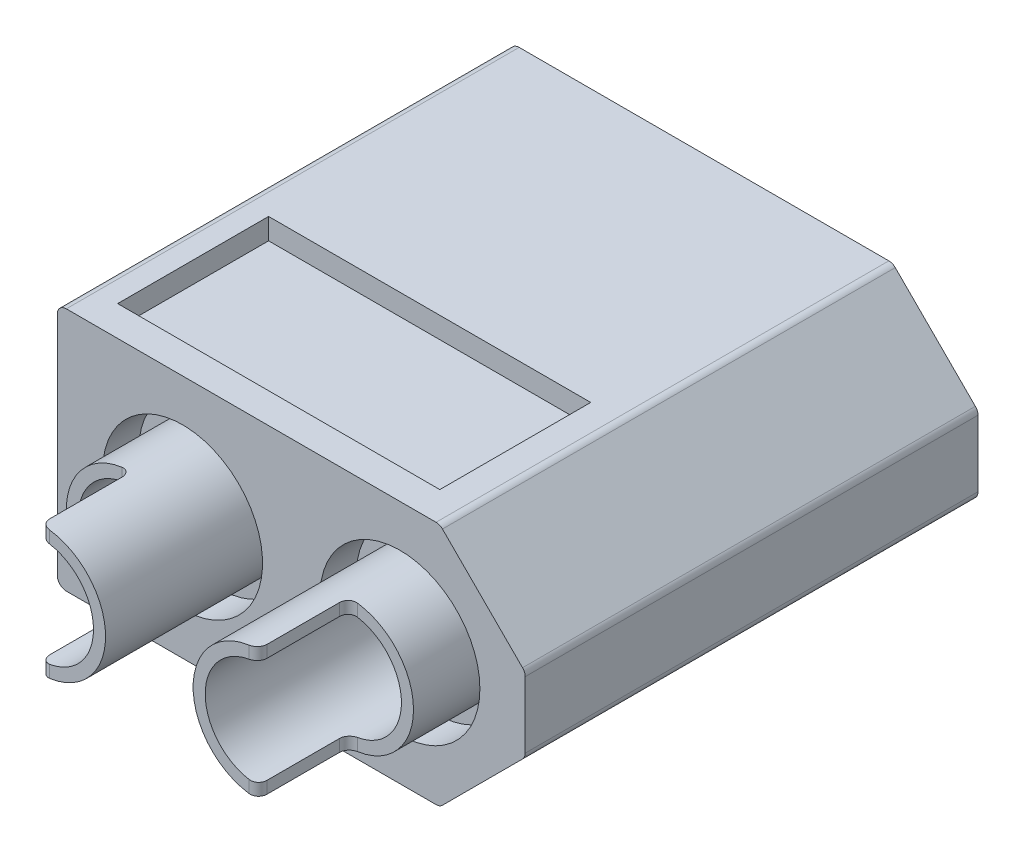
from build123d import *

# Parameters (mm, degrees)
EXTRUDE_1_DEPTH          = 15
CUT_EXTRUDE_1_DEPTH      = 7.7
SKETCH_3_W               = 1.5
SKETCH_3_H               = 1.2
EXTRUDE_2_DEPTH          = 6.2
SKETCH_4_W               = 1.5
SKETCH_4_H               = 4
CUT_EXTRUDE_2_DEPTH      = 1.2
EXTRUDE_3_DEPTH          = 6.5
EXTRUDE_3_DEPTH_BACK     = 12
SKETCH_5_R               = 2.15
SKETCH_6_R               = 2.65
SKETCH_6_R_2             = 2.15
CUT_EXTRUDE_3_DEPTH      = 1.2
SKETCH_7_R               = 1.75
CUT_EXTRUDE_4_DEPTH      = 9
CUT_EXTRUDE_5_DEPTH      = 22.553537993
CUT_EXTRUDE_5_DEPTH_BACK = 22.553537993
SKETCH_8_W               = 2.15
SKETCH_8_H               = 3
CUT_EXTRUDE_START        = -5.5
SKETCH_10_R              = 2.15
SKETCH_10_R_2            = 1.95
CUT_EXTRUDE_7_DEPTH      = 5.5
CUT_EXTRUDE_START_2      = -6
CUT_EXTRUDE_6_DEPTH      = 6
FILLET_1_R               = 1
FILLET_2_R               = 0.3
SKETCH_11_W              = 10.671572875
SKETCH_11_H              = 5
CUT_EXTRUDE_8_DEPTH      = 0.7
SKETCH_12_W              = 0.743589744
SKETCH_12_H              = 0.230769231
EXTRUDE_4_DEPTH          = 0.2
FILLET_3_R               = 0.3


with BuildPart() as part:
    # Эскиз1 → Бобышка-Вытянуть1 (new body)
    with BuildSketch(Plane.XY):
        Polygon((7.75, 1.221572875), (4.921572875, 4.05), (-7.75, 4.05), (-7.75, -4.05), (4.921572875, -4.05), (7.75, -1.221572875), align=None)
    extrude(amount=EXTRUDE_1_DEPTH)

    # Эскиз2 → Вырез-Вытянуть1 (cut)
    with BuildSketch(Plane(origin=(0, 0, 0), x_dir=(-1, 0, 0), z_dir=(0, 0, -1))):
        Polygon((-4.631623382, -3.35), (7.05, -3.35), (7.05, 3.35), (-4.631623382, 3.35), (-7.05, 0.931623382), (-7.05, -0.931623382), align=None)
    extrude(amount=-CUT_EXTRUDE_1_DEPTH, mode=Mode.SUBTRACT)

    # Эскиз3 → Бобышка-Вытянуть2 (add)
    with BuildSketch(Plane(origin=(0, 0, 1.5), x_dir=(-1, 0, 0), z_dir=(0, 0, -1))):
        with Locations((0, 2.75)):
            Rectangle(SKETCH_3_W, SKETCH_3_H)
    extrude(amount=-EXTRUDE_2_DEPTH)

    # Эскиз4 → Вырез-Вытянуть2 (cut)
    with BuildSketch(Plane(origin=(0, 0, 7.7), x_dir=(-1, 0, 0), z_dir=(0, 0, -1))):
        with Locations((0, 0.15)):
            Rectangle(SKETCH_4_W, SKETCH_4_H)
    extrude(amount=-CUT_EXTRUDE_2_DEPTH, mode=Mode.SUBTRACT)

    # Эскиз5 → Бобышка-Вытянуть3 (add, two sides: drawn at the far end of the back side and taken through both)
    with BuildSketch(Plane(origin=(0, 0, 7.7), x_dir=(-1, 0, 0), z_dir=(0, 0, -1)).offset(-EXTRUDE_3_DEPTH_BACK)):
        with Locations(Location((3.6, 0, 0), (0, 0, 180))):
            Circle(SKETCH_5_R)
        with Locations(Location((-3.6, 0, 0), (0, 0, 180))):
            Circle(SKETCH_5_R)
    extrude(amount=EXTRUDE_3_DEPTH + EXTRUDE_3_DEPTH_BACK)

    # Эскиз6 → Вырез-Вытянуть3 (cut)
    # profile 1 of 2: a face of its own
    with BuildSketch(Plane.XY.offset(15)):
        with Locations((3.6, 0)):
            Circle(SKETCH_6_R)
        with Locations((3.6, 0)):
            Circle(SKETCH_6_R_2, mode=Mode.SUBTRACT)
    # profile 2 of 2: a face of its own
    with BuildSketch(Plane.XY.offset(15)):
        with Locations(Location((-3.6, 0, 0), (0, 0, 180))):
            Circle(SKETCH_6_R)
        with Locations((-3.6, 0)):
            Circle(SKETCH_6_R_2, mode=Mode.SUBTRACT)
    extrude(amount=-CUT_EXTRUDE_3_DEPTH, mode=Mode.SUBTRACT)

    # Эскиз7 → Вырез-Вытянуть4 (cut)
    with BuildSketch(Plane.XY.offset(19.7)):
        with Locations((-3.6, 0)):
            Circle(SKETCH_7_R)
        with Locations(Location((3.6, 0, 0), (0, 0, 180))):
            Circle(SKETCH_7_R)
    extrude(amount=-CUT_EXTRUDE_4_DEPTH, mode=Mode.SUBTRACT)

    # Эскиз8 → Вырез-Вытянуть5 (cut, two sides: drawn at the far end of the back side and taken through both)
    with BuildSketch(Plane(origin=(0, 0, 0), x_dir=(1, 0, 0), z_dir=(0, 1, 0)).offset(-CUT_EXTRUDE_5_DEPTH_BACK)):
        with Locations((4.675, -18.2)):
            Rectangle(SKETCH_8_W, SKETCH_8_H)
        with Locations((-4.675, -18.2)):
            Rectangle(SKETCH_8_W, SKETCH_8_H)
    extrude(amount=CUT_EXTRUDE_5_DEPTH + CUT_EXTRUDE_5_DEPTH_BACK, mode=Mode.SUBTRACT)

    # Эскиз10 → Вырез-Вытянуть7 (cut)
    # profile 1 of 2: a face of its own
    with BuildSketch(Plane(origin=(0, 0, 1.2), x_dir=(-1, 0, 0), z_dir=(0, 0, -1)).offset(CUT_EXTRUDE_START)):
        with Locations(Location((3.6, 0, 0), (0, 0, 180))):
            Circle(SKETCH_10_R)
        with Locations((3.6, 0)):
            Circle(SKETCH_10_R_2, mode=Mode.SUBTRACT)
    # profile 2 of 2: a face of its own
    with BuildSketch(Plane(origin=(0, 0, 1.2), x_dir=(-1, 0, 0), z_dir=(0, 0, -1)).offset(CUT_EXTRUDE_START)):
        with Locations(Location((-3.6, 0, 0), (0, 0, 180))):
            Circle(SKETCH_10_R)
        with Locations(Location((-3.6, 0, 0), (0, 0, 180))):
            Circle(SKETCH_10_R_2, mode=Mode.SUBTRACT)
    extrude(amount=CUT_EXTRUDE_7_DEPTH, mode=Mode.SUBTRACT)

    # Эскиз9 → Вырез-Вытянуть6 (cut)
    with BuildSketch(Plane(origin=(0, 0, 1.2), x_dir=(-1, 0, 0), z_dir=(0, 0, -1)).offset(CUT_EXTRUDE_START_2)):
        with BuildLine():
            ThreePointArc((3.45, -1.94422221), (3.6, -1.95), (3.75, -1.94422221))
            Line((3.75, -1.94422221), (3.75, -0.734846923))
            ThreePointArc((3.75, -0.734846923), (4.130330086, -0.530330086), (4.334846923, -0.15))
            Line((4.334846923, -0.15), (5.54422221, -0.15))
            ThreePointArc((5.54422221, -0.15), (5.548555017, -0.075055617), (5.55, 0))
            ThreePointArc((5.55, 0), (5.548555017, 0.075055617), (5.54422221, 0.15))
            Line((5.54422221, 0.15), (4.334846923, 0.15))
            ThreePointArc((4.334846923, 0.15), (4.130330086, 0.530330086), (3.75, 0.734846923))
            Line((3.75, 0.734846923), (3.75, 1.94422221))
            ThreePointArc((3.75, 1.94422221), (3.6, 1.95), (3.45, 1.94422221))
            Line((3.45, 1.94422221), (3.45, 0.734846923))
            ThreePointArc((3.45, 0.734846923), (3.069669914, 0.530330086), (2.865153077, 0.15))
            Line((2.865153077, 0.15), (1.65577779, 0.15))
            ThreePointArc((1.65577779, 0.15), (1.65, 0), (1.65577779, -0.15))
            Line((1.65577779, -0.15), (2.865153077, -0.15))
            ThreePointArc((2.865153077, -0.15), (3.069669914, -0.530330086), (3.45, -0.734846923))
            Line((3.45, -0.734846923), (3.45, -1.94422221))
        make_face()
        with BuildLine():
            ThreePointArc((-3.75, -0.734846923), (-4.130330086, -0.530330086), (-4.334846923, -0.15))
            Line((-4.334846923, -0.15), (-6.1, -0.15))
            Line((-6.1, -0.15), (-6.1, 0.15))
            Line((-6.1, 0.15), (-4.334846923, 0.15))
            ThreePointArc((-4.334846923, 0.15), (-4.130330086, 0.530330086), (-3.75, 0.734846923))
            Line((-3.75, 0.734846923), (-3.75, 2.5))
            Line((-3.75, 2.5), (-3.45, 2.5))
            Line((-3.45, 2.5), (-3.45, 0.734846923))
            ThreePointArc((-3.45, 0.734846923), (-3.069669914, 0.530330086), (-2.865153077, 0.15))
            Line((-2.865153077, 0.15), (-1.1, 0.15))
            Line((-1.1, 0.15), (-1.1, -0.15))
            Line((-1.1, -0.15), (-2.865153077, -0.15))
            ThreePointArc((-2.865153077, -0.15), (-3.069669914, -0.530330086), (-3.45, -0.734846923))
            Line((-3.45, -0.734846923), (-3.45, -2.5))
            Line((-3.45, -2.5), (-3.75, -2.5))
            Line((-3.75, -2.5), (-3.75, -0.734846923))
        make_face()
    extrude(amount=CUT_EXTRUDE_6_DEPTH, mode=Mode.SUBTRACT)

    # Скругление1
    fillet_1_edges = [part.edges().sort_by_distance(p)[0] for p in [
        (4.978858223, -1.378858223, 1.2),
        (-4.978858223, 1.378858223, 1.2),
        (-2.221141777, 1.378858223, 1.2),
        (-2.221141777, -1.378858223, 1.2),
        (-4.978858223, -1.378858223, 1.2),
        (2.221141777, -1.378858223, 1.2),
        (2.221141777, 1.378858223, 1.2),
        (4.978858223, 1.378858223, 1.2),
    ]]
    fillet(fillet_1_edges, radius=FILLET_1_R)

    # Скругление2
    fillet_2_edges = [part.edges().sort_by_distance(p)[0] for p in [
        (-3.6, 1.95, 16.7),
        (-3.6, -1.95, 16.7),
        (-3.6, 1.95, 19.7),
        (-3.6, -1.95, 19.7),
        (3.6, -1.95, 19.7),
        (3.6, 1.95, 19.7),
        (3.6, 1.95, 16.7),
        (3.6, -1.95, 16.7),
    ]]
    fillet(fillet_2_edges, radius=FILLET_2_R)

    # Эскиз11 → Вырез-Вытянуть8 (cut)
    with BuildSketch(Plane(origin=(0, 4.05, 0), x_dir=(1, 0, 0), z_dir=(0, 1, 0))):
        with Locations((-1.414213562, -11.5)):
            Rectangle(SKETCH_11_W, SKETCH_11_H)
    cut_extrude_8 = extrude(amount=-CUT_EXTRUDE_8_DEPTH, mode=Mode.SUBTRACT)

    # Зеркальное отражение1: Вырез-Вытянуть8 across plane
    add(cut_extrude_8.mirror(Plane.ZX), mode=Mode.SUBTRACT)

    # Эскиз12 → Бобышка-Вытянуть4 (add)
    # profile 1 of 5: a face of its own
    with BuildSketch(Plane.XZ.offset(3.35)):
        with BuildLine():
            Line((2.409553644, 12.5), (1.670370952, 11.423878205))
            Line((1.670370952, 11.423878205), (2.306989542, 10.5))
            Line((2.306989542, 10.5), (1.967245952, 10.5))
            Line((1.967245952, 10.5), (1.618287619, 11.006410256))
            add(Edge.make_bspline(
                [(1.618287619, 11.006410256), (1.609716279, 11.019080657), (1.593631875, 11.042857083), (1.57132612, 11.076612212), (1.552930289, 11.106570753), (1.538116623, 11.132498509), (1.52669851, 11.154212753), (1.518724987, 11.171824354), (1.514563909, 11.185833759), (1.514533668, 11.193896175), (1.514521593, 11.197115385)],
                knots=[0, 0, 0, 0, 1.676374632, 3.145772549, 4.433387901, 5.527971266, 6.418173079, 7.119576872, 7.648459376, 8, 8, 8, 8], degree=3))
            add(Edge.make_bspline(
                [(1.514521593, 11.197115385), (1.505939018, 11.184719792), (1.487172134, 11.157615267), (1.45748844, 11.112979609), (1.42192354, 11.062359172), (1.397091731, 11.026070545), (1.383912619, 11.006810897)],
                knots=[0, 0, 0, 0, 0.783829651, 1.713942406, 2.786709065, 4, 4, 4, 4], degree=3))
            Line((1.383912619, 11.006810897), (1.036156209, 10.5))
            Line((1.036156209, 10.5), (0.691604927, 10.5))
            Line((0.691604927, 10.5), (1.328223516, 11.427083333))
            Line((1.328223516, 11.427083333), (0.589040824, 12.5))
            Line((0.589040824, 12.5), (0.929185055, 12.5))
            Line((0.929185055, 12.5), (1.415963901, 11.793269231))
            add(Edge.make_bspline(
                [(1.415963901, 11.793269231), (1.429874296, 11.773252023), (1.457377052, 11.733675264), (1.484627598, 11.693924429), (1.498095311, 11.674278846)],
                knots=[0, 0, 0, 0, 1.011563749, 2, 2, 2, 2], degree=3))
            add(Edge.make_bspline(
                [(1.498095311, 11.674278846), (1.508350537, 11.689255237), (1.527228888, 11.716824555), (1.55350676, 11.754365325), (1.574243279, 11.785462974), (1.58675493, 11.803696514), (1.592245952, 11.811698718)],
                knots=[0, 0, 0, 0, 1.307556106, 2.407017115, 3.300883259, 4, 4, 4, 4], degree=3))
            Line((1.592245952, 11.811698718), (2.065403003, 12.5))
            Line((2.065403003, 12.5), (2.409553644, 12.5))
        make_face()
    # profile 2 of 5: a face of its own
    with BuildSketch(Plane.XZ.offset(3.35)):
        Polygon((-0.142529689, 12.5), (-0.142529689, 10.730769231), (0.498495952, 10.730769231), (0.498495952, 10.5), (-1.065606612, 10.5), (-1.065606612, 10.730769231), (-0.424580971, 10.730769231), (-0.424580971, 12.5), align=None)
    # profile 3 of 5: a face of its own
    with BuildSketch(Plane.XZ.offset(3.35)):
        with Locations((-1.565606612, 11.794871795)):
            Rectangle(SKETCH_12_W, SKETCH_12_H)
    # profile 4 of 5: a face of its own
    with BuildSketch(Plane.XZ.offset(3.35)):
        with BuildLine():
            Line((-3.424580971, 11.012820513), (-3.168170714, 11.038461538))
            add(Edge.make_bspline(
                [(-3.168170714, 11.038461538), (-3.162637587, 11.016408888), (-3.152222327, 10.974898169), (-3.130381624, 10.91859514), (-3.106313636, 10.870972353), (-3.085403784, 10.845328798), (-3.075622638, 10.833333333)],
                knots=[0, 0, 0, 0, 1.199207122, 2.257322842, 3.184815751, 4, 4, 4, 4], degree=3))
            add(Edge.make_bspline(
                [(-3.075622638, 10.833333333), (-3.067226661, 10.825151768), (-3.050713717, 10.809060522), (-3.023605475, 10.788085468), (-2.9950289, 10.770314351), (-2.964897623, 10.755917051), (-2.933374427, 10.744544011), (-2.900328735, 10.736587964), (-2.865835411, 10.731662719), (-2.842332519, 10.731069596), (-2.83043033, 10.730769231)],
                knots=[0, 0, 0, 0, 1.028360939, 2.022547923, 3.001693811, 3.976902288, 4.948369586, 5.937776631, 6.955661634, 8, 8, 8, 8], degree=3))
            add(Edge.make_bspline(
                [(-2.83043033, 10.730769231), (-2.811134834, 10.731390522), (-2.773007776, 10.732618166), (-2.717068568, 10.744636707), (-2.662735872, 10.762624371), (-2.629074759, 10.780858577), (-2.612080971, 10.790064103)],
                knots=[0, 0, 0, 0, 1.010336883, 1.996381556, 2.988474728, 4, 4, 4, 4], degree=3))
            add(Edge.make_bspline(
                [(-2.612080971, 10.790064103), (-2.59537236, 10.803912925), (-2.56107358, 10.832341244), (-2.516363185, 10.88468468), (-2.476649304, 10.945809013), (-2.446911914, 11.002745022), (-2.426541131, 11.054257959), (-2.412351814, 11.098054129), (-2.401070683, 11.146626062), (-2.391441398, 11.199575079), (-2.384061741, 11.257099567), (-2.377872313, 11.319201225), (-2.374453831, 11.386047922), (-2.373691836, 11.432154801), (-2.37329892, 11.455929487)],
                knots=[0, 0, 0, 0, 1.063396562, 2.182898711, 3.360648584, 4.635554171, 5.326740425, 6.076945788, 6.892323083, 7.771510239, 8.716835194, 9.737306867, 10.833258317, 12, 12, 12, 12], degree=3))
            add(Edge.make_bspline(
                [(-2.37329892, 11.455929487), (-2.388420961, 11.43469649), (-2.418023281, 11.393131602), (-2.470229671, 11.338585363), (-2.52758291, 11.292872348), (-2.589479701, 11.256067808), (-2.654415686, 11.227532663), (-2.721371139, 11.207718738), (-2.789707267, 11.194410277), (-2.835976791, 11.193011877), (-2.859276484, 11.192307692)],
                knots=[0, 0, 0, 0, 1.08413448, 2.122259381, 3.131196715, 4.128532876, 5.111902129, 6.075762527, 7.031022177, 8, 8, 8, 8], degree=3))
            add(Edge.make_bspline(
                [(-2.859276484, 11.192307692), (-2.879335113, 11.192845725), (-2.91896475, 11.193908711), (-2.977312599, 11.202381502), (-3.033173293, 11.217040687), (-3.087066674, 11.236596477), (-3.138280419, 11.262548345), (-3.187680871, 11.293421129), (-3.234181975, 11.330776705), (-3.278361884, 11.372807852), (-3.318791772, 11.41951955), (-3.354011769, 11.470048104), (-3.384084754, 11.523760209), (-3.407994953, 11.580986561), (-3.426942067, 11.641468391), (-3.440466388, 11.705170597), (-3.448607312, 11.772225119), (-3.449675511, 11.817952311), (-3.450221997, 11.841346154)],
                knots=[0, 0, 0, 0, 0.98160025, 1.939337942, 2.877944864, 3.804478064, 4.739961265, 5.683019169, 6.650831814, 7.654132266, 8.664499124, 9.669140276, 10.664058004, 11.671756914, 12.699296594, 13.762159139, 14.855129872, 16, 16, 16, 16], degree=3))
            add(Edge.make_bspline(
                [(-3.450221997, 11.841346154), (-3.449205427, 11.872255519), (-3.447194921, 11.933386097), (-3.431638092, 12.023309385), (-3.405678589, 12.109657753), (-3.376234965, 12.178595328), (-3.347397901, 12.230599027), (-3.324243576, 12.267706456), (-3.298763247, 12.302235538), (-3.271791207, 12.334809164), (-3.24215088, 12.364348465), (-3.21154256, 12.392310663), (-3.178266318, 12.417064942), (-3.143670898, 12.440019531), (-3.107048998, 12.459876988), (-3.069422525, 12.477656034), (-3.030442368, 12.492515667), (-2.990212902, 12.504432747), (-2.948914587, 12.514189149), (-2.906331794, 12.520915132), (-2.86256527, 12.525058779), (-2.832977051, 12.525445441), (-2.818010458, 12.525641026)],
                knots=[0, 0, 0, 0, 1.777706882, 3.515835744, 5.23207167, 6.95628682, 7.816020017, 8.65165611, 9.4707737, 10.283378767, 11.082060806, 11.8764812, 12.666355411, 13.46551777, 14.263312302, 15.060773764, 15.858457287, 16.660642738, 17.473247806, 18.298111139, 19.139134514, 20, 20, 20, 20], degree=3))
            add(Edge.make_bspline(
                [(-2.818010458, 12.525641026), (-2.792735334, 12.524938361), (-2.743166371, 12.523560313), (-2.670602852, 12.513024679), (-2.601625446, 12.495255436), (-2.536114005, 12.470889101), (-2.474210085, 12.439399352), (-2.416128389, 12.400504218), (-2.361618956, 12.354685003), (-2.310604758, 12.301918347), (-2.264520387, 12.24080908), (-2.224345295, 12.170788215), (-2.191437737, 12.091274476), (-2.163643309, 12.003260159), (-2.143064917, 11.905912626), (-2.127194496, 11.799860676), (-2.118847099, 11.684695575), (-2.117556794, 11.604979563), (-2.116888663, 11.563701923)],
                knots=[0, 0, 0, 0, 0.898449204, 1.762016875, 2.600428026, 3.426826527, 4.242280324, 5.064055083, 5.906691075, 6.769749479, 7.668135943, 8.621070442, 9.631748766, 10.722023185, 11.898351526, 13.165512303, 14.532277789, 16, 16, 16, 16], degree=3))
            add(Edge.make_bspline(
                [(-2.116888663, 11.563701923), (-2.117049841, 11.540196231), (-2.117367705, 11.493840044), (-2.119657083, 11.425557414), (-2.124171207, 11.359705733), (-2.130104644, 11.296370871), (-2.137749588, 11.23545144), (-2.146723511, 11.176986922), (-2.15817292, 11.121059142), (-2.170770587, 11.067544552), (-2.18538483, 11.016406407), (-2.201089624, 10.967580201), (-2.219316507, 10.921423671), (-2.238879294, 10.877657175), (-2.260166926, 10.836344837), (-2.282829754, 10.797327861), (-2.307881587, 10.761106742), (-2.325898454, 10.738419539), (-2.334837381, 10.727163462)],
                knots=[0, 0, 0, 0, 1.280444348, 2.525197649, 3.720942618, 4.875526429, 5.989898656, 7.065115415, 8.096622082, 9.098853712, 10.059152529, 10.993162051, 11.891531392, 12.760921141, 13.603603485, 14.422073071, 15.217123906, 16, 16, 16, 16], degree=3))
            add(Edge.make_bspline(
                [(-2.334837381, 10.727163462), (-2.350989046, 10.70899602), (-2.382825478, 10.673186305), (-2.437287603, 10.626928637), (-2.495321585, 10.587417471), (-2.557852996, 10.555495869), (-2.624403905, 10.530608764), (-2.695016033, 10.512542931), (-2.76988642, 10.502065995), (-2.821048955, 10.500699827), (-2.847257253, 10.5)],
                knots=[0, 0, 0, 0, 1.005002357, 1.980952959, 2.948226316, 3.90482984, 4.879026092, 5.883055346, 6.915583142, 8, 8, 8, 8], degree=3))
            add(Edge.make_bspline(
                [(-2.847257253, 10.5), (-2.86677224, 10.500344965), (-2.905111005, 10.501022676), (-2.96128708, 10.507525381), (-3.0147204, 10.518393677), (-3.065529973, 10.533053793), (-3.113420355, 10.55256828), (-3.158943666, 10.57569506), (-3.201637653, 10.603515122), (-3.241193233, 10.635648383), (-3.277708384, 10.671183953), (-3.310414496, 10.710420241), (-3.339188337, 10.752868229), (-3.364254919, 10.798616198), (-3.385390251, 10.847447594), (-3.40274341, 10.899572287), (-3.415932968, 10.954976883), (-3.421658345, 10.993272039), (-3.424580971, 11.012820513)],
                knots=[0, 0, 0, 0, 1.095988384, 2.15315746, 3.171326302, 4.156539379, 5.119213808, 6.072133135, 7.021027441, 7.975952916, 8.930907862, 9.879001051, 10.840359051, 11.807350428, 12.805278655, 13.825435679, 14.889953203, 16, 16, 16, 16], degree=3))
        make_face()
        with BuildLine():
            add(Edge.make_bspline(
                [(-2.37329892, 11.836137821), (-2.374016018, 11.856213389), (-2.375440802, 11.896100972), (-2.386198612, 11.955203172), (-2.404061977, 12.012786088), (-2.428196125, 12.068390574), (-2.458310035, 12.120150218), (-2.493638173, 12.166310329), (-2.534083597, 12.205660233), (-2.579378434, 12.238011519), (-2.628921456, 12.263145841), (-2.682004972, 12.282004486), (-2.739041753, 12.292884687), (-2.778301196, 12.294199421), (-2.798379048, 12.294871795)],
                knots=[0, 0, 0, 0, 1.034371533, 2.055163721, 3.085036369, 4.136219926, 5.172765015, 6.164074703, 7.123048089, 8.070464312, 9.021723619, 9.977430468, 10.965628467, 12, 12, 12, 12], degree=3))
            add(Edge.make_bspline(
                [(-2.798379048, 12.294871795), (-2.812690159, 12.294486512), (-2.840624182, 12.293734474), (-2.881512736, 12.287856191), (-2.920445828, 12.278971799), (-2.957240692, 12.265374111), (-2.992153593, 12.248728978), (-3.025010708, 12.227923664), (-3.055820971, 12.203541393), (-3.084251981, 12.175428661), (-3.109950844, 12.144170883), (-3.132278854, 12.109949786), (-3.151996819, 12.07333114), (-3.166827816, 12.033414304), (-3.17891295, 11.991222112), (-3.187797826, 11.946355567), (-3.193014184, 11.89876317), (-3.193542038, 11.866065532), (-3.19381174, 11.849358974)],
                knots=[0, 0, 0, 0, 1.023462019, 1.997707343, 2.950204755, 3.875082018, 4.798131411, 5.712685617, 6.65128003, 7.603921197, 8.567945975, 9.540503156, 10.523517238, 11.53671457, 12.580096959, 13.661292135, 14.805058716, 16, 16, 16, 16], degree=3))
            add(Edge.make_bspline(
                [(-3.19381174, 11.849358974), (-3.193561894, 11.833315809), (-3.193073288, 11.801941374), (-3.187564715, 11.756161109), (-3.179560946, 11.712876171), (-3.167163442, 11.672361028), (-3.152247701, 11.634380147), (-3.133566861, 11.599044367), (-3.111406427, 11.566386561), (-3.085814449, 11.536495797), (-3.05750731, 11.509542871), (-3.026154579, 11.486496695), (-2.992561433, 11.466927595), (-2.95649212, 11.450661568), (-2.917896572, 11.438290921), (-2.87679645, 11.429702383), (-2.833409855, 11.423711558), (-2.803608807, 11.423291711), (-2.788363022, 11.423076923)],
                knots=[0, 0, 0, 0, 1.155242457, 2.259222408, 3.317825484, 4.322358011, 5.306829979, 6.253722241, 7.195762508, 8.144412979, 9.083697585, 10.00547228, 10.941152501, 11.87999348, 12.850638972, 13.854618393, 14.902453872, 16, 16, 16, 16], degree=3))
            add(Edge.make_bspline(
                [(-2.788363022, 11.423076923), (-2.774184247, 11.423298248), (-2.746243624, 11.423734389), (-2.705270727, 11.42977617), (-2.665772448, 11.438366622), (-2.627947455, 11.450919976), (-2.591737693, 11.466841249), (-2.557566667, 11.486935563), (-2.524376069, 11.509510899), (-2.493912735, 11.53655677), (-2.465362075, 11.565737548), (-2.440941046, 11.598093723), (-2.419976401, 11.63229562), (-2.402520201, 11.668583243), (-2.38925884, 11.70731939), (-2.38025744, 11.748333398), (-2.374451693, 11.791502067), (-2.373689156, 11.821027749), (-2.37329892, 11.836137821)],
                knots=[0, 0, 0, 0, 1.03701548, 2.04353757, 3.025450354, 3.993097303, 4.955942005, 5.915106969, 6.891406964, 7.889250744, 8.89182446, 9.875341956, 10.849485896, 11.824610452, 12.817027865, 13.839237692, 14.894207727, 16, 16, 16, 16], degree=3))
        make_face(mode=Mode.SUBTRACT)
    # profile 5 of 5: a face of its own
    with BuildSketch(Plane.XZ.offset(3.35)):
        with BuildLine():
            add(Edge.make_bspline(
                [(-3.706632253, 11.513621795), (-3.706890656, 11.485039973), (-3.70739676, 11.429060219), (-3.710534126, 11.347151553), (-3.716016862, 11.269367139), (-3.724184061, 11.195770668), (-3.73392896, 11.126079417), (-3.746412589, 11.06047911), (-3.760658444, 10.998896055), (-3.777544534, 10.94156398), (-3.796410046, 10.887888035), (-3.817455203, 10.837717161), (-3.841420529, 10.791307626), (-3.866282669, 10.747554607), (-3.894569606, 10.708136888), (-3.924294567, 10.671622779), (-3.956362694, 10.638646505), (-3.990911519, 10.609367576), (-4.027673214, 10.583518907), (-4.066532033, 10.561084992), (-4.107768103, 10.541976676), (-4.151497732, 10.527006592), (-4.197295279, 10.514957676), (-4.24534197, 10.506050662), (-4.295723462, 10.500810114), (-4.330150848, 10.500273089), (-4.347657894, 10.5)],
                knots=[0, 0, 0, 0, 1.514548985, 2.966363668, 4.342801279, 5.645536807, 6.88951609, 8.070636169, 9.18292944, 10.237633186, 11.23586543, 12.196673567, 13.117642805, 14.002448775, 14.860474521, 15.685016546, 16.495716207, 17.293997176, 18.081286888, 18.873901753, 19.668661895, 20.485546082, 21.319749152, 22.176139114, 23.072528574, 24, 24, 24, 24], degree=3))
            add(Edge.make_bspline(
                [(-4.347657894, 10.5), (-4.373346462, 10.500743326), (-4.423812684, 10.502203621), (-4.497400266, 10.51446378), (-4.566965807, 10.53453621), (-4.631981814, 10.562470303), (-4.691591996, 10.598255154), (-4.745050089, 10.641255911), (-4.791064941, 10.692113515), (-4.830545767, 10.749788852), (-4.864430478, 10.814264364), (-4.89473289, 10.884987116), (-4.92190442, 10.962241245), (-4.941792159, 11.031199548), (-4.955735368, 11.09082742), (-4.964224366, 11.140099821), (-4.972062177, 11.19310179), (-4.977617723, 11.249960266), (-4.983270943, 11.3104095), (-4.986062006, 11.37471308), (-4.988192, 11.44282734), (-4.988516618, 11.489581254), (-4.988683535, 11.513621795)],
                knots=[0, 0, 0, 0, 1.134392726, 2.228560011, 3.285421824, 4.326686528, 5.345663051, 6.348245061, 7.346442277, 8.364444627, 9.428234171, 10.559369172, 11.76117748, 13.044149777, 13.72830454, 14.465558531, 15.252424724, 16.094928615, 16.989169351, 17.934396366, 18.93788079, 20, 20, 20, 20], degree=3))
            add(Edge.make_bspline(
                [(-4.988683535, 11.513621795), (-4.988421798, 11.542069597), (-4.987910444, 11.59764798), (-4.984836252, 11.678896633), (-4.979096984, 11.756105619), (-4.97170601, 11.829370433), (-4.961737764, 11.898754369), (-4.949361176, 11.963975928), (-4.934879576, 12.025190667), (-4.918595562, 12.082644495), (-4.899809539, 12.136463947), (-4.878522974, 12.186580591), (-4.855284658, 12.233382515), (-4.829697881, 12.276632219), (-4.801894822, 12.316472572), (-4.772324524, 12.353168674), (-4.740164834, 12.386210404), (-4.705480837, 12.415430087), (-4.668969528, 12.441755587), (-4.629897576, 12.464275364), (-4.588355717, 12.483062434), (-4.54471437, 12.498764476), (-4.498683817, 12.5106977), (-4.450503913, 12.519557801), (-4.399860324, 12.524849837), (-4.365298783, 12.525373657), (-4.347657894, 12.525641026)],
                knots=[0, 0, 0, 0, 1.508950488, 2.948031798, 4.311688408, 5.614950163, 6.853137481, 8.028455569, 9.134944892, 10.188708076, 11.194600246, 12.156350049, 13.075032267, 13.964295672, 14.819092354, 15.649926205, 16.461420415, 17.260483761, 18.05264124, 18.846032929, 19.648010917, 20.468054852, 21.303075505, 22.167271292, 23.064539283, 24, 24, 24, 24], degree=3))
            add(Edge.make_bspline(
                [(-4.347657894, 12.525641026), (-4.324529162, 12.524981277), (-4.2794345, 12.52369495), (-4.213577072, 12.514955146), (-4.151766362, 12.499572681), (-4.093481034, 12.478942626), (-4.03937623, 12.45134874), (-3.989193621, 12.417775389), (-3.941924824, 12.379003694), (-3.914714031, 12.348413716), (-3.90094315, 12.332932692)],
                knots=[0, 0, 0, 0, 1.10322584, 2.150986741, 3.161425019, 4.136713905, 5.093944212, 6.049774532, 7.013026876, 8, 8, 8, 8], degree=3))
            add(Edge.make_bspline(
                [(-3.90094315, 12.332932692), (-3.88509255, 12.310067969), (-3.852407934, 12.262919931), (-3.814153426, 12.182528153), (-3.780029726, 12.094028093), (-3.753248879, 11.995683389), (-3.732272799, 11.888276756), (-3.717122833, 11.771597437), (-3.708549443, 11.645695842), (-3.707285743, 11.558640309), (-3.706632253, 11.513621795)],
                knots=[0, 0, 0, 0, 0.779365345, 1.607084704, 2.489375761, 3.438383567, 4.461919411, 5.557722155, 6.737039282, 8, 8, 8, 8], degree=3))
        make_face()
        with BuildLine():
            add(Edge.make_bspline(
                [(-3.963042509, 11.512820513), (-3.963297104, 11.551287787), (-3.963784455, 11.624922659), (-3.968876092, 11.730122778), (-3.977641134, 11.825027645), (-3.989229093, 11.909505858), (-4.00452989, 11.983671691), (-4.023741851, 12.047336146), (-4.0453983, 12.101263342), (-4.072197745, 12.144784892), (-4.101540177, 12.180261303), (-4.131834233, 12.210772165), (-4.163792628, 12.236705698), (-4.197206836, 12.258328977), (-4.232595303, 12.274700702), (-4.269571062, 12.286566966), (-4.308142158, 12.293395818), (-4.334410827, 12.294376995), (-4.347657894, 12.294871795)],
                knots=[0, 0, 0, 0, 1.89448813, 3.626469325, 5.185477471, 6.587276848, 7.82441448, 8.910550357, 9.859733512, 10.6775885, 11.416198291, 12.123144072, 12.791880183, 13.439617036, 14.078171869, 14.70637855, 15.347637704, 16, 16, 16, 16], degree=3))
            add(Edge.make_bspline(
                [(-4.347657894, 12.294871795), (-4.360901751, 12.294366314), (-4.387164055, 12.293363956), (-4.425822707, 12.286683786), (-4.46266046, 12.274213761), (-4.497974003, 12.257872984), (-4.531787722, 12.236800502), (-4.563308216, 12.210293699), (-4.593941824, 12.179875468), (-4.622971402, 12.143993849), (-4.649947746, 12.100487759), (-4.671563283, 12.046526313), (-4.690792566, 11.98287364), (-4.706043323, 11.908831162), (-4.717713696, 11.824499242), (-4.726414817, 11.72985358), (-4.731543876, 11.624790051), (-4.73202269, 11.551288056), (-4.732273279, 11.512820513)],
                knots=[0, 0, 0, 0, 0.652578524, 1.294050225, 1.924494109, 2.563260593, 3.207694917, 3.880813851, 4.587993952, 5.331957758, 6.150083828, 7.099581593, 8.186077474, 9.42362516, 10.819375359, 12.378900244, 14.104883934, 16, 16, 16, 16], degree=3))
            add(Edge.make_bspline(
                [(-4.732273279, 11.512820513), (-4.732030466, 11.475153445), (-4.731565245, 11.402984768), (-4.726307295, 11.299811373), (-4.71806781, 11.206499312), (-4.706796897, 11.122963294), (-4.691819761, 11.049291683), (-4.673648778, 10.98533489), (-4.652012972, 10.931206987), (-4.626233752, 10.8864332), (-4.597650583, 10.849473919), (-4.567281698, 10.81810633), (-4.5357148, 10.790617859), (-4.50114597, 10.76909382), (-4.465044782, 10.751441003), (-4.426637342, 10.739623633), (-4.386419571, 10.732039336), (-4.358911446, 10.731198792), (-4.344853407, 10.730769231)],
                knots=[0, 0, 0, 0, 1.850145643, 3.544809038, 5.072983816, 6.450691362, 7.683229814, 8.76276662, 9.712991103, 10.538891656, 11.292051756, 12.001912283, 12.681449089, 13.342071824, 13.996410874, 14.649960216, 15.310061595, 16, 16, 16, 16], degree=3))
            add(Edge.make_bspline(
                [(-4.344853407, 10.730769231), (-4.331605466, 10.731113273), (-4.305482225, 10.731791679), (-4.267263788, 10.738387135), (-4.230879722, 10.749153965), (-4.196572164, 10.764685423), (-4.164001525, 10.783953724), (-4.133128282, 10.807389773), (-4.104692654, 10.835714763), (-4.087579271, 10.856936176), (-4.078827766, 10.867788462)],
                knots=[0, 0, 0, 0, 1.021462953, 2.014194051, 2.982449609, 3.941891643, 4.91211921, 5.897280499, 6.924703483, 8, 8, 8, 8], degree=3))
            add(Edge.make_bspline(
                [(-4.078827766, 10.867788462), (-4.06929736, 10.883721565), (-4.049171148, 10.917368926), (-4.026659476, 10.975851239), (-4.006696107, 11.042801959), (-3.990481911, 11.119046972), (-3.978484133, 11.20448157), (-3.969191921, 11.298969498), (-3.964318276, 11.402860436), (-3.963479498, 11.475155876), (-3.963042509, 11.512820513)],
                knots=[0, 0, 0, 0, 0.671109831, 1.417242661, 2.260125669, 3.199948126, 4.23589883, 5.382398214, 6.636276086, 8, 8, 8, 8], degree=3))
        make_face(mode=Mode.SUBTRACT)
    extrude(amount=EXTRUDE_4_DEPTH)

    # Скругление3
    fillet_3_edges = [part.edges().sort_by_distance(p)[0] for p in [
        (-7.75, -4.05, 7.5),
        (-7.75, 4.05, 7.5),
        (4.921572875, 4.05, 7.5),
        (7.75, 1.221572875, 7.5),
        (7.75, -1.221572875, 7.5),
        (4.921572875, -4.05, 7.5),
    ]]
    fillet(fillet_3_edges, radius=FILLET_3_R)


solid = part.part
